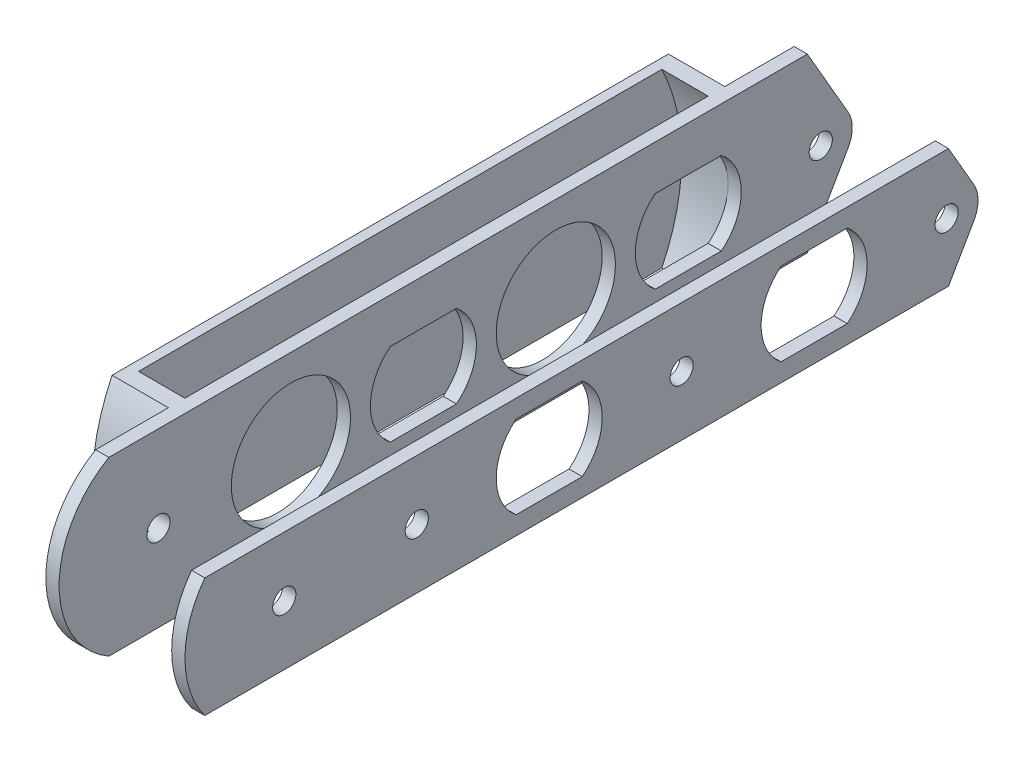
from build123d import *
from build123d.topology import SkipClean

# Parameters (mm, degrees)
SKETCH1_R           = 1.75
BOSS_EXTRUDE1_DEPTH = 2
BOSS_EXTRUDE4_START = -17
SKETCH1_10_R        = 1.75
SKETCH1_10_R_2      = 9
BOSS_EXTRUDE4_DEPTH = 2
BOSS_EXTRUDE5_START = 7
BOSS_EXTRUDE5_DEPTH = 7
BOSS_EXTRUDE6_START = 1.5
BOSS_EXTRUDE6_DEPTH = 1.5


with BuildPart() as part:
    # Sketch1 → Boss-Extrude1 (new body)
    with BuildSketch(Plane(origin=(0, 0, 0), x_dir=(0, 0, -1), z_dir=(1, 0, 0))):
        with BuildLine():
            Line((-52, 9), (60.288675135, 9))
            Line((60.288675135, 9), (64.113620668, 2.375))
            ThreePointArc((64.113620668, 2.375), (64.75, 0), (64.113620668, -2.375))
            Line((64.113620668, -2.375), (60.288675135, -9))
            Line((60.288675135, -9), (-52, -9))
            ThreePointArc((-52, -9), (-55, 0), (-52, 9))
        make_face()
        with Locations((20, 0)):
            Circle(SKETCH1_R, mode=Mode.SUBTRACT)
        with Locations((-20, 0)):
            Circle(SKETCH1_R, mode=Mode.SUBTRACT)
        with Locations((-40, 0)):
            Circle(SKETCH1_R, mode=Mode.SUBTRACT)
        with Locations((60, 0)):
            Circle(SKETCH1_R, mode=Mode.SUBTRACT)
        with BuildLine():
            Line((44.993746089, 6.25), (35.006253911, 6.25))
            ThreePointArc((35.006253911, 6.25), (32, 0), (35.006253911, -6.25))
            Line((35.006253911, -6.25), (44.993746089, -6.25))
            ThreePointArc((44.993746089, -6.25), (48, 0), (44.993746089, 6.25))
        make_face(mode=Mode.SUBTRACT)
        with BuildLine():
            Line((4.993746089, -6.25), (-4.993746089, -6.25))
            ThreePointArc((-4.993746089, -6.25), (-8, 0), (-4.993746089, 6.25))
            Line((-4.993746089, 6.25), (4.993746089, 6.25))
            ThreePointArc((4.993746089, 6.25), (8, 0), (4.993746089, -6.25))
        make_face(mode=Mode.SUBTRACT)
    extrude(amount=BOSS_EXTRUDE1_DEPTH)


with BuildPart() as body_2:
    # Sketch1<10> → Boss-Extrude4 (new body)
    with BuildSketch(Plane(origin=(0, 0, 0), x_dir=(0, 0, -1), z_dir=(1, 0, 0)).offset(BOSS_EXTRUDE4_START)):
        with BuildLine():
            ThreePointArc((-47.483314774, 13), (-55, 0), (-47.483314774, -13))
            Line((-47.483314774, -13), (57.979274058, -13))
            Line((57.979274058, -13), (64.113620668, -2.375))
            ThreePointArc((64.113620668, -2.375), (64.75, 0), (64.113620668, 2.375))
            Line((64.113620668, 2.375), (57.979274058, 13))
            Line((57.979274058, 13), (-47.483314774, 13))
        make_face()
        with Locations((-40, 0)):
            Circle(SKETCH1_10_R, mode=Mode.SUBTRACT)
        with Locations((-20, 0)):
            Circle(SKETCH1_10_R_2, mode=Mode.SUBTRACT)
        with BuildLine():
            Line((4.993746089, -6.25), (-4.993746089, -6.25))
            ThreePointArc((-4.993746089, -6.25), (-8, 0), (-4.993746089, 6.25))
            Line((-4.993746089, 6.25), (4.993746089, 6.25))
            ThreePointArc((4.993746089, 6.25), (8, 0), (4.993746089, -6.25))
        make_face(mode=Mode.SUBTRACT)
        with Locations((20, 0)):
            Circle(SKETCH1_10_R_2, mode=Mode.SUBTRACT)
        with BuildLine():
            Line((35.006253911, 6.25), (44.993746089, 6.25))
            ThreePointArc((44.993746089, 6.25), (48, 0), (44.993746089, -6.25))
            Line((44.993746089, -6.25), (35.006253911, -6.25))
            ThreePointArc((35.006253911, -6.25), (32, 0), (35.006253911, 6.25))
        make_face(mode=Mode.SUBTRACT)
        with Locations((60, 0)):
            Circle(SKETCH1_10_R, mode=Mode.SUBTRACT)
    extrude(amount=-BOSS_EXTRUDE4_DEPTH)

    # Sketch5 → Boss-Extrude5 (add)
    with SkipClean():  # the faces are left unmerged after this step: merging them gives an invalid solid
        with BuildSketch(Plane.ZY.offset(19).offset(BOSS_EXTRUDE5_START)):
            with BuildLine():
                Line((36.5, 13), (34, 13))
                ThreePointArc((34, 13), (36.994876185, 0.551349937), (34.464700993, -12))
                ThreePointArc((34.464700993, -12), (34.236997105, -12.502159284), (34, -13))
                Line((34, -13), (36.5, -13))
                ThreePointArc((36.5, -13), (38.54193302, -7.478463419), (39.453383978, -1.662441254))
                ThreePointArc((39.453383978, -1.662441254), (38.25, 0), (39.453383978, 1.662441254))
                ThreePointArc((39.453383978, 1.662441254), (38.54193302, 7.478463419), (36.5, 13))
            make_face()
            with BuildLine():
                ThreePointArc((-45, 13), (-48, 0), (-45, -13))
                Line((-45, -13), (-47.5, -13))
                ThreePointArc((-47.5, -13), (-50.5, 0), (-47.5, 13))
                Line((-47.5, 13), (-45, 13))
            make_face()
        extrude(amount=-BOSS_EXTRUDE5_DEPTH)

    # Sketch6 → Boss-Extrude6 (add)
    with SkipClean():  # the faces are left unmerged after this step: merging them gives an invalid solid
        with BuildSketch(Plane.ZY.offset(26).offset(BOSS_EXTRUDE6_START)):
            with BuildLine():
                Line((-47.5, 13), (36.5, 13))
                ThreePointArc((36.5, 13), (38.54193302, 7.478463419), (39.453383978, 1.662441254))
                ThreePointArc((39.453383978, 1.662441254), (38.25, 0), (39.453383978, -1.662441254))
                ThreePointArc((39.453383978, -1.662441254), (38.54193302, -7.478463419), (36.5, -13))
                Line((36.5, -13), (-47.5, -13))
                ThreePointArc((-47.5, -13), (-50.5, 0), (-47.5, 13))
            make_face()
        extrude(amount=-BOSS_EXTRUDE6_DEPTH)


solid = Compound([part.part, body_2.part])
